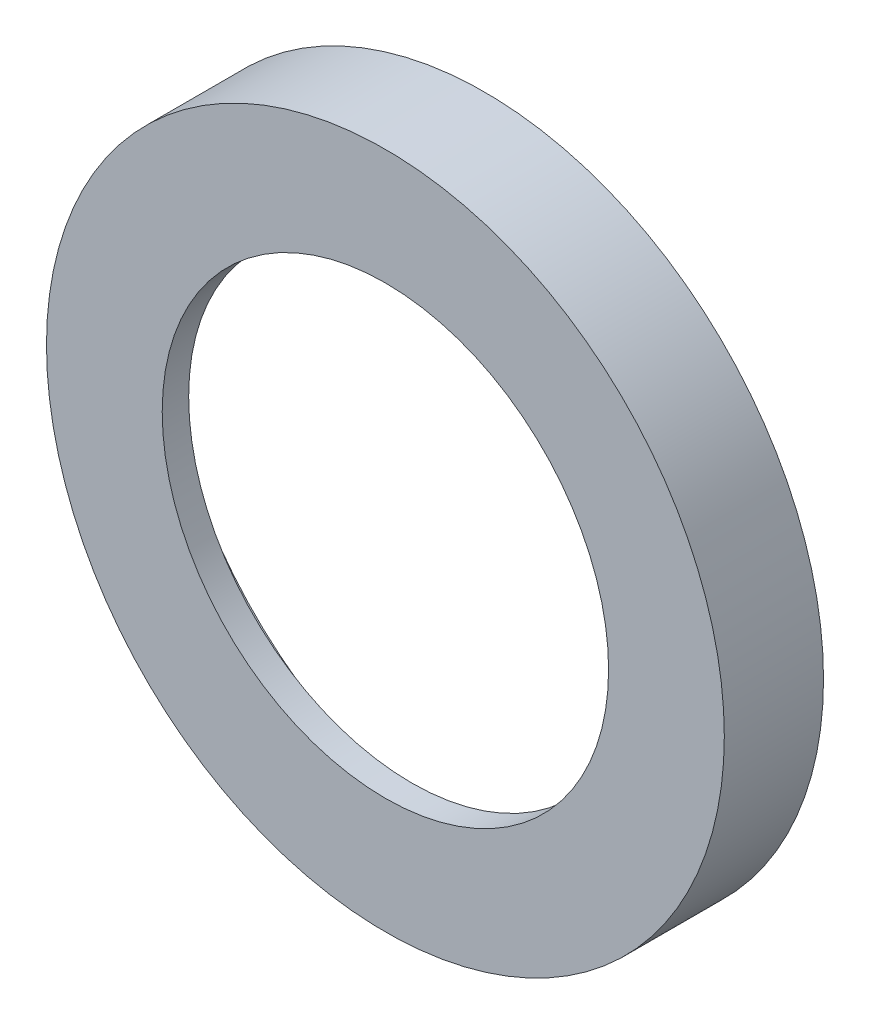
from build123d import *

# Parameters (mm, degrees)
ESBO_O1_R                = 10.25
RESSALTO_EXTRUS_O1_DEPTH = 3
ESBO_O2_R                = 9.8
CORTE_EXTRUS_O1_DEPTH    = 2.2
ESBO_O3_R                = 6.75
CORTE_EXTRUS_O2_DEPTH    = 15.66168476


with BuildPart() as part:
    # Esboço1 → Ressalto-extrusão1 (new body)
    with BuildSketch(Plane.XY):
        Circle(ESBO_O1_R)
    extrude(amount=RESSALTO_EXTRUS_O1_DEPTH)

    # Esboço2 → Corte-extrusão1 (cut)
    with BuildSketch(Plane(origin=(0, 0, 0), x_dir=(-1, 0, 0), z_dir=(0, 0, -1))):
        Circle(ESBO_O2_R)
    extrude(amount=-CORTE_EXTRUS_O1_DEPTH, mode=Mode.SUBTRACT)

    # Esboço3 → Corte-extrusão2 (cut, through all)
    with BuildSketch(Plane(origin=(0, 0, 2.2), x_dir=(-1, 0, 0), z_dir=(0, 0, -1))):
        Circle(ESBO_O3_R)
    extrude(amount=-CORTE_EXTRUS_O2_DEPTH, mode=Mode.SUBTRACT)


solid = part.part
